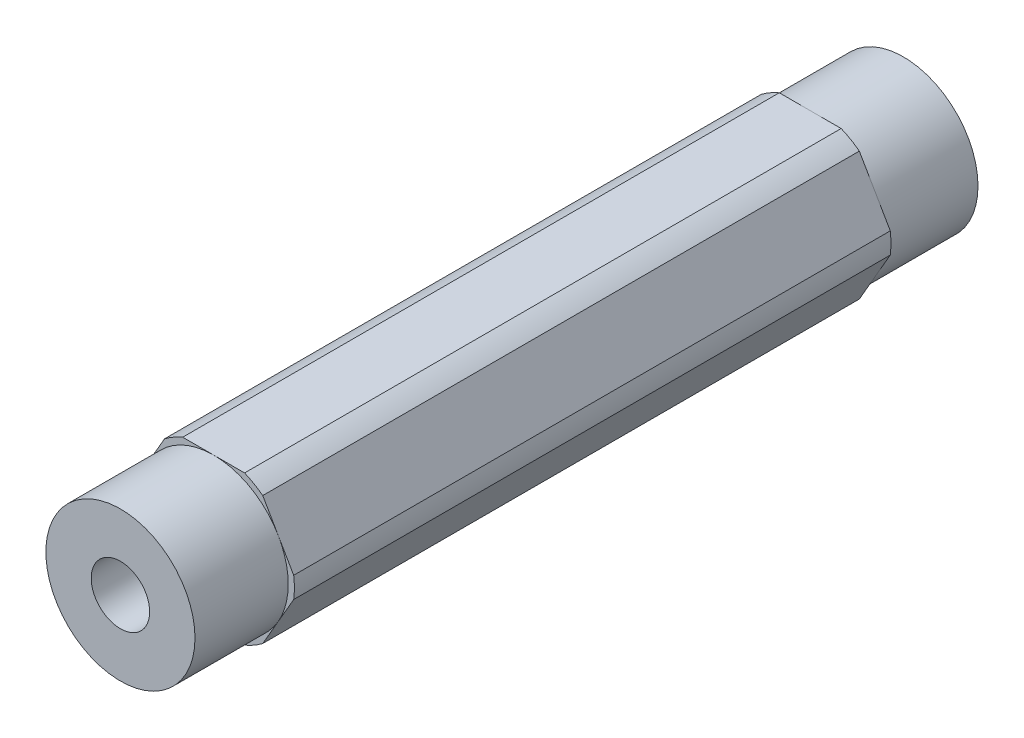
from build123d import *

# Parameters (mm, degrees)
SKETCH1_R           = 2.4892
BOSS_EXTRUDE1_DEPTH = 33.3375
CUT_EXTRUDE2_DEPTH  = 7.9375


with BuildPart() as part:
    # Sketch1 → Boss-Extrude1 (new, symmetric)
    with BuildSketch(Plane.XY):
        with BuildLine():
            ThreePointArc((-2.634980936, 6.35), (-3.437499983, 5.953924622), (-4.181770846, 5.456960429))
            Line((-4.181770846, 5.456960429), (-6.816751782, 0.893039571))
            ThreePointArc((-6.816751782, 0.893039571), (-6.874999966, 0), (-6.816751782, -0.893039571))
            Line((-6.816751782, -0.893039571), (-4.181770846, -5.456960429))
            ThreePointArc((-4.181770846, -5.456960429), (-3.437499983, -5.953924622), (-2.634980936, -6.35))
            Line((-2.634980936, -6.35), (2.634980936, -6.35))
            ThreePointArc((2.634980936, -6.35), (3.437499983, -5.953924622), (4.181770846, -5.456960429))
            Line((4.181770846, -5.456960429), (6.816751782, -0.893039571))
            ThreePointArc((6.816751782, -0.893039571), (6.860422465, -0.447468582), (6.874999966, 0))
            ThreePointArc((6.874999966, 0), (6.860422465, 0.447468582), (6.816751782, 0.893039571))
            Line((6.816751782, 0.893039571), (4.181770846, 5.456960429))
            ThreePointArc((4.181770846, 5.456960429), (3.437499983, 5.953924622), (2.634980936, 6.35))
            Line((2.634980936, 6.35), (-2.634980936, 6.35))
        make_face()
        Circle(SKETCH1_R, mode=Mode.SUBTRACT)
    extrude(amount=BOSS_EXTRUDE1_DEPTH, both=True)

    # Sketch2 → Cut-Extrude2 (cut)
    with BuildSketch(Plane.XY.offset(33.3375)):
        with BuildLine():
            ThreePointArc((-5.499261332, 3.174999968), (-3.175000008, 5.499261309), (1.8e-08, 6.35))
            Line((1.8e-08, 6.35), (-2.634980936, 6.35))
            ThreePointArc((-2.634980936, 6.35), (-3.437499983, 5.953924622), (-4.181770846, 5.456960429))
            Line((-4.181770846, 5.456960429), (-5.499261332, 3.174999968))
        make_face()
        with BuildLine():
            ThreePointArc((1.8e-08, 6.35), (3.175000042, 5.49926129), (5.499261354, 3.174999932))
            Line((5.499261354, 3.174999932), (4.181770846, 5.456960429))
            ThreePointArc((4.181770846, 5.456960429), (3.437499983, 5.953924622), (2.634980936, 6.35))
            Line((2.634980936, 6.35), (1.8e-08, 6.35))
        make_face()
        with BuildLine():
            ThreePointArc((5.499261354, 3.174999932), (6.133629007, 1.643500898), (6.35, 0))
            ThreePointArc((6.35, 0), (6.133629, -1.643500924), (5.499261327, -3.174999977))
            Line((5.499261327, -3.174999977), (6.816751782, -0.893039571))
            ThreePointArc((6.816751782, -0.893039571), (6.874999966, 0), (6.816751782, 0.893039571))
            Line((6.816751782, 0.893039571), (5.499261354, 3.174999932))
        make_face()
        with BuildLine():
            Line((4.181770846, -5.456960429), (5.499261327, -3.174999977))
            ThreePointArc((5.499261327, -3.174999977), (3.175000011, -5.499261308), (0, -6.35))
            Line((0, -6.35), (2.634980936, -6.35))
            ThreePointArc((2.634980936, -6.35), (3.437499983, -5.953924622), (4.181770846, -5.456960429))
        make_face()
        with BuildLine():
            Line((-2.634980936, -6.35), (0, -6.35))
            ThreePointArc((0, -6.35), (-3.174999938, -5.49926135), (-5.499261242, -3.175000124))
            Line((-5.499261242, -3.175000124), (-4.181770846, -5.456960429))
            ThreePointArc((-4.181770846, -5.456960429), (-3.437499983, -5.953924622), (-2.634980936, -6.35))
        make_face()
        with BuildLine():
            ThreePointArc((-5.499261242, -3.175000124), (-6.35, -9e-08), (-5.499261332, 3.174999968))
            Line((-5.499261332, 3.174999968), (-6.816751782, 0.893039571))
            ThreePointArc((-6.816751782, 0.893039571), (-6.874999966, 0), (-6.816751782, -0.893039571))
            Line((-6.816751782, -0.893039571), (-5.499261242, -3.175000124))
        make_face()
    cut_extrude2 = extrude(amount=-CUT_EXTRUDE2_DEPTH, mode=Mode.SUBTRACT)

    # Mirror1: Cut-Extrude2 across plane
    add(cut_extrude2.mirror(Plane.XY), mode=Mode.SUBTRACT)


solid = part.part
